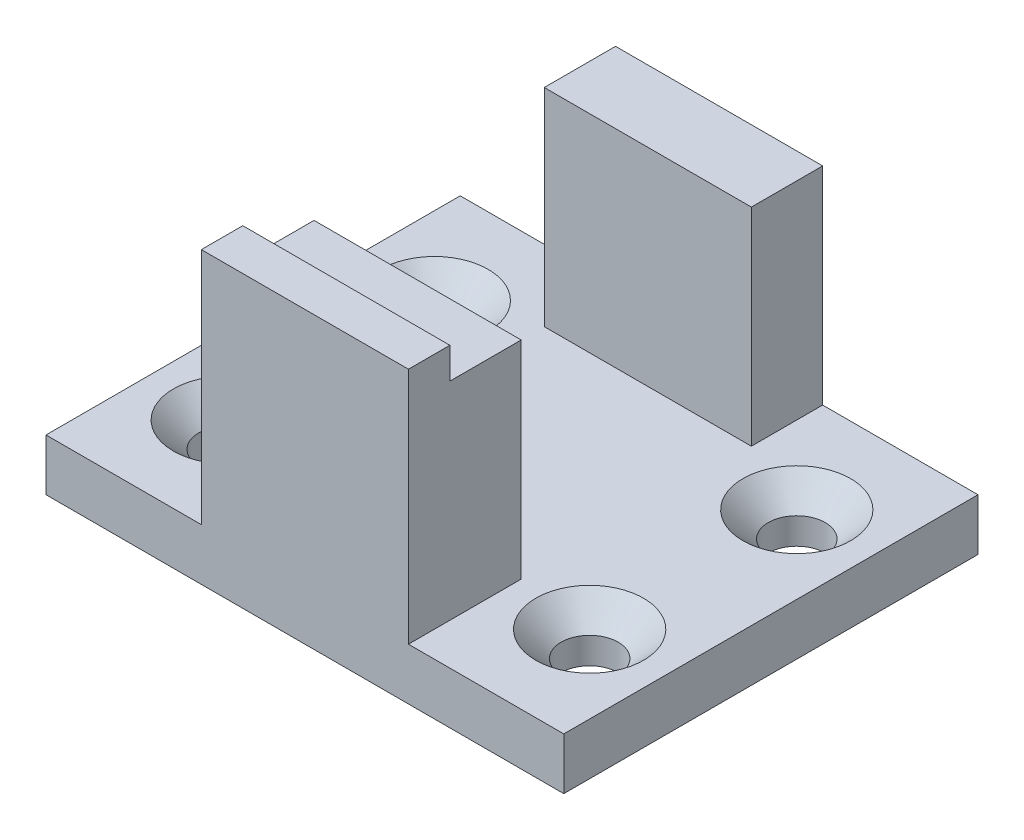
from build123d import *

# Parameters (mm, degrees)
SKETCH1_W                                    = 20
SKETCH1_H                                    = 40
BOSS_EXTRUDE1_DEPTH                          = 25
SKETCH2_W                                    = 20
SKETCH2_H                                    = 4
BOSS_EXTRUDE2_DEPTH                          = 3
SKETCH3_W                                    = 22.23
SKETCH3_H                                    = 20
CUT_EXTRUDE1_DEPTH                           = 20
SKETCH4_W                                    = 15
SKETCH4_H                                    = 40
BOSS_EXTRUDE3_DEPTH                          = 5
CSK_FOR_M5_COUNTERSUNK_FLAT_HEAD_SCR_2_COUNT = 2
CSK_FOR_M5_COUNTERSUNK_FLAT_HEAD_SCR_2_PITCH = 20


with BuildPart() as part:
    # Sketch1 → Boss-Extrude1 (new body)
    with BuildSketch(Plane(origin=(0, 0, 0), x_dir=(1, 0, 0), z_dir=(0, 1, 0))):
        with Locations((10, -20)):
            Rectangle(SKETCH1_W, SKETCH1_H)
    extrude(amount=BOSS_EXTRUDE1_DEPTH)

    # Sketch2 → Boss-Extrude2 (add)
    with BuildSketch(Plane(origin=(0, 25, 0), x_dir=(1, 0, 0), z_dir=(0, 1, 0))):
        with Locations((10, -38)):
            Rectangle(SKETCH2_W, SKETCH2_H)
    extrude(amount=BOSS_EXTRUDE2_DEPTH)

    # Sketch3 → Cut-Extrude1 (cut)
    with BuildSketch(Plane.ZY):
        with Locations((18, 15)):
            Rectangle(SKETCH3_W, SKETCH3_H)
    extrude(amount=-CUT_EXTRUDE1_DEPTH, mode=Mode.SUBTRACT)

    # Sketch4 → Boss-Extrude3 (add)
    with BuildSketch(Plane(origin=(0, 0, 0), x_dir=(1, 0, 0), z_dir=(0, 1, 0))):
        with Locations((-7.5, -20)):
            Rectangle(SKETCH4_W, SKETCH4_H)
    boss_extrude3 = extrude(amount=BOSS_EXTRUDE3_DEPTH)

    # Sketch8 → CSK for M5 Countersunk Flat Head Screw1 (revolve, cut)
    with BuildSketch(Plane(origin=(-7.5, 5, 10), x_dir=(0, 0, 1), z_dir=(1, 0, 0))):
        Polygon((0, 0), (0, 5), (2.75, 5), (2.75, 2.45), (5.2, 0), align=None)
    csk_for_m5_countersunk_flat_head_screw1 = revolve(axis=Axis((-7.5, 11.35, 10), (0, -1, 0)), mode=Mode.SUBTRACT)

    # CSK for M5 Countersunk Flat Head Scr 2: CSK for M5 Countersunk Flat Head Screw1 ×2
    with Locations(*[(0, 0, i * CSK_FOR_M5_COUNTERSUNK_FLAT_HEAD_SCR_2_PITCH) for i in range(1, CSK_FOR_M5_COUNTERSUNK_FLAT_HEAD_SCR_2_COUNT)]):
        add(csk_for_m5_countersunk_flat_head_screw1, mode=Mode.SUBTRACT)

    # Mirror1: Boss-Extrude3, CSK for M5 Countersunk Flat Head Screw1 across plane
    add(boss_extrude3.mirror(Plane.ZY.offset(-10)))
    add(csk_for_m5_countersunk_flat_head_screw1.mirror(Plane.ZY.offset(-10)), mode=Mode.SUBTRACT)

    # Mirror1 copy 1 sketch → Mirror1 copy 1 (revolve, cut)
    with BuildSketch(Plane(origin=(27.5, 5, 30), x_dir=(0, 0, 1), z_dir=(-1, 0, 0))):
        Polygon((0, 0), (0, -5), (2.75, -5), (2.75, -2.45), (5.2, 0), align=None)
    revolve(axis=Axis((27.5, 11.35, 30), (0, 1, 0)), mode=Mode.SUBTRACT)


solid = part.part
